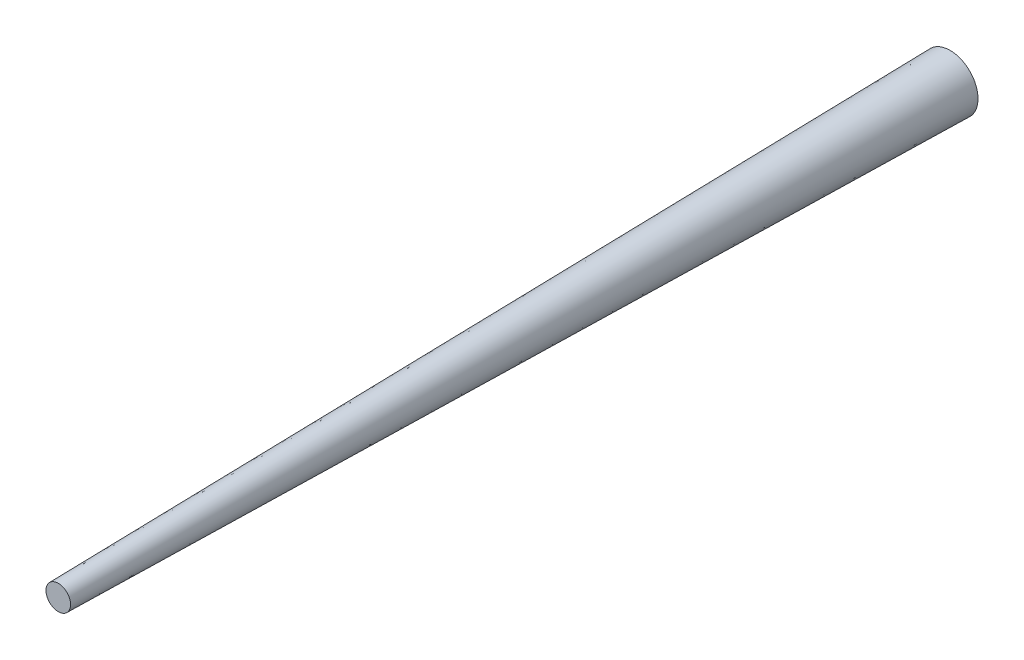
from build123d import *

# Parameters (mm, degrees)
ESBO_O1_R                = 5
RESSALTO_EXTRUS_O1_DEPTH = 160
RESSALTO_EXTRUS_O1_TAPER = 1


with BuildPart() as part:
    # Esboço1 → Ressalto-extrusão1 (new body)
    with BuildSketch(Plane.XY):
        Circle(ESBO_O1_R)
    extrude(amount=RESSALTO_EXTRUS_O1_DEPTH, taper=RESSALTO_EXTRUS_O1_TAPER)


solid = part.part
